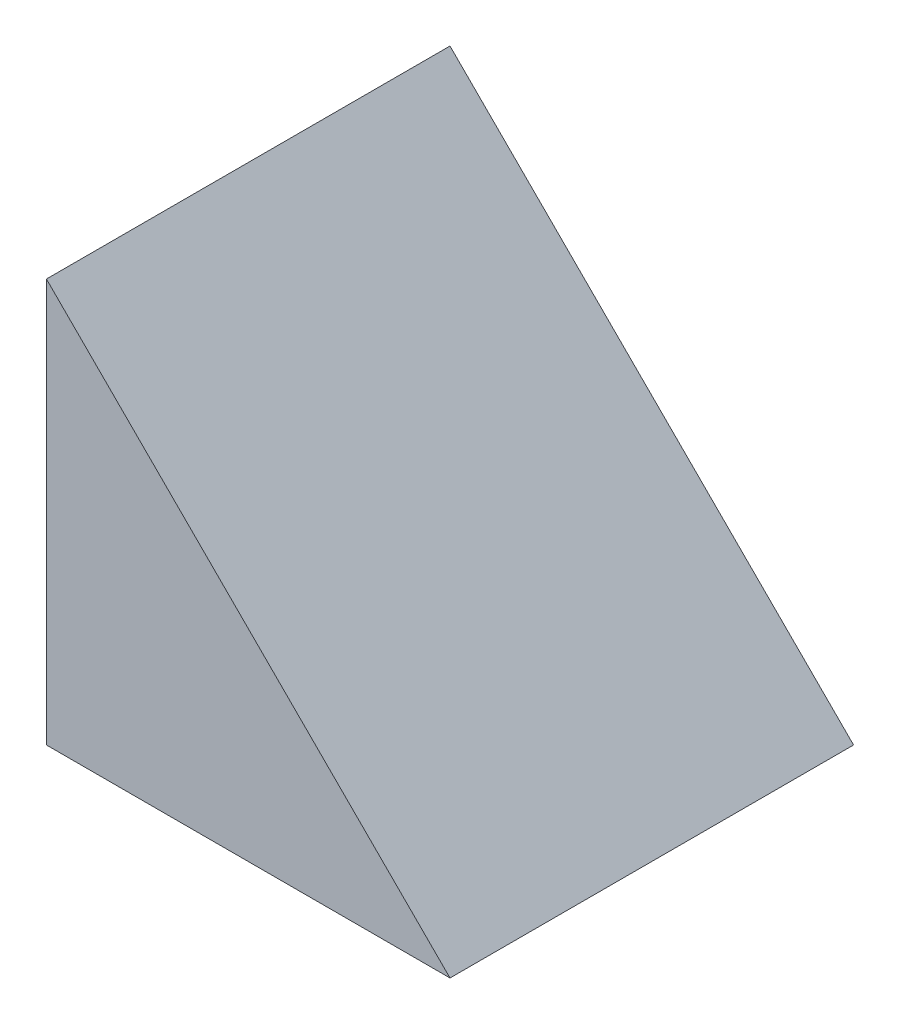
from build123d import *

# Parameters (mm, degrees)
BOSS_EXTRUDE1_DEPTH = 30


with BuildPart() as part:
    # Sketch1 → Boss-Extrude1 (new body)
    with BuildSketch(Plane.XY):
        Polygon((0, 0), (0, 30), (30, 0), align=None)
    extrude(amount=BOSS_EXTRUDE1_DEPTH)


solid = part.part
